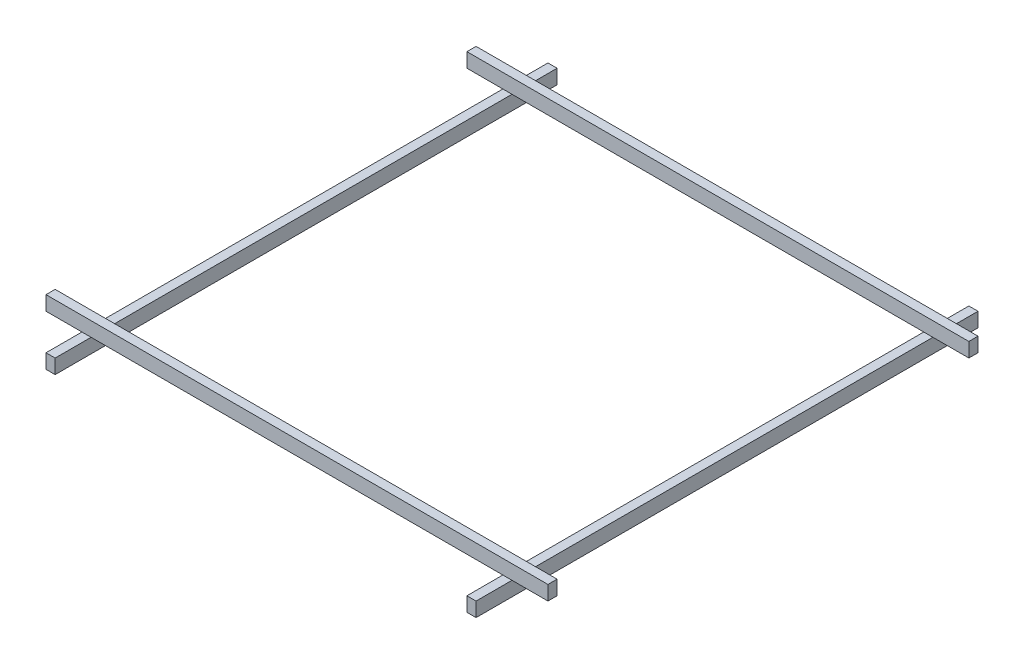
from build123d import *

# Parameters (mm, degrees)
SKETCH1_W              = 88.9
SKETCH1_H              = 139.7
PROFILES_4X6_1_DEPTH   = 4876.8
SKETCH1_ON_SEGMENT_2_W = 88.9
SKETCH1_ON_SEGMENT_2_H = 139.7
PROFILES_4X6_1_2_DEPTH = 4876.8
SKETCH1_ON_SEGMENT_3_W = 88.9
SKETCH1_ON_SEGMENT_3_H = 139.7
PROFILES_4X6_1_3_DEPTH = 4876.8
SKETCH1_ON_SEGMENT_4_W = 88.9
SKETCH1_ON_SEGMENT_4_H = 139.7
PROFILES_4X6_1_4_DEPTH = 4876.8


with BuildPart() as part:
    # Sketch1 → Profiles 4X6(1) (new body)
    with BuildSketch(Plane(origin=(88.9, 0, 0), x_dir=(-1, 0, 0), z_dir=(0, 0, -1))):
        Rectangle(SKETCH1_W, SKETCH1_H)
    extrude(amount=PROFILES_4X6_1_DEPTH)


with BuildPart() as body_2:
    # Sketch1 on segment 2 (carried to segment 2) → Profiles 4X6_1 2 (new body)
    with BuildSketch(Plane(origin=(4178.3, 0, 0), x_dir=(-1, 0, 0), z_dir=(0, 0, -1))):
        Rectangle(SKETCH1_ON_SEGMENT_2_W, SKETCH1_ON_SEGMENT_2_H)
    extrude(amount=PROFILES_4X6_1_2_DEPTH)


with BuildPart() as body_3:
    # Sketch1 on segment 3 (carried to segment 3) → Profiles 4X6_1 3 (new body)
    with BuildSketch(Plane(origin=(-304.8, 139.7, -4483.1), x_dir=(0, 0, -1), z_dir=(1, 0, 0))):
        Rectangle(SKETCH1_ON_SEGMENT_3_W, SKETCH1_ON_SEGMENT_3_H)
    extrude(amount=PROFILES_4X6_1_3_DEPTH)


with BuildPart() as body_4:
    # Sketch1 on segment 4 (carried to segment 4) → Profiles 4X6_1 4 (new body)
    with BuildSketch(Plane(origin=(4572, 139.7, -393.7), x_dir=(0, 0, 1), z_dir=(-1, 0, 0))):
        Rectangle(SKETCH1_ON_SEGMENT_4_W, SKETCH1_ON_SEGMENT_4_H)
    extrude(amount=PROFILES_4X6_1_4_DEPTH)


solid = Compound([part.part, body_2.part, body_3.part, body_4.part])
